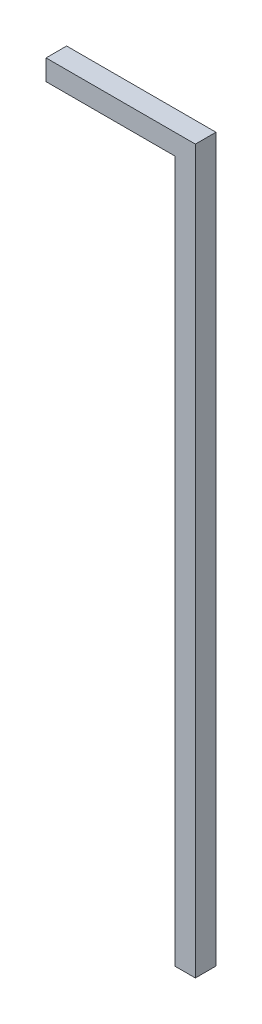
from build123d import *

# Parameters (mm, degrees)
BOSS_EXTRUDE1_DEPTH = 20


with BuildPart() as part:
    # Sketch1 → Boss-Extrude1 (new body)
    with BuildSketch(Plane.XY):
        Polygon((259.044918033, 201.491721311), (404.044918033, 201.491721311), (404.044918033, -499.838278689), (384.044918033, -499.838278689), (384.044918033, 181.491721311), (259.044918033, 181.491721311), align=None)
    extrude(amount=BOSS_EXTRUDE1_DEPTH)


solid = part.part
